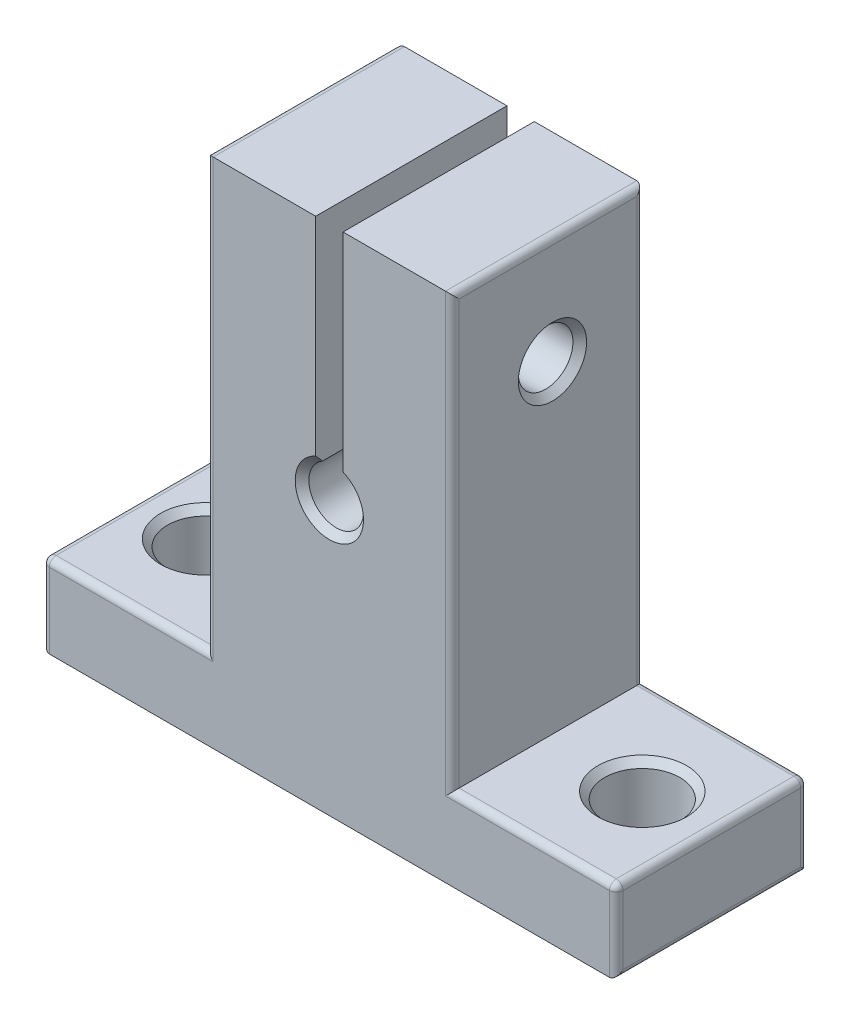
from build123d import *

# Parameters (mm, degrees)
BOSS_EXTRUDE1_DEPTH     = 7
SKETCH2_R               = 2.75
CUT_EXTRUDE1_DEPTH      = 39.5
CUT_EXTRUDE2_DEPTH      = 42.512046444
CUT_EXTRUDE2_DEPTH_BACK = 42.512046444
SKETCH5_R               = 2
CHAMFER2_SIZE           = 0.5
FILLET2_R               = 0.5


with BuildPart() as part:
    # Sketch1 → Boss-Extrude1 (new, symmetric)
    with BuildSketch(Plane.XY):
        with BuildLine():
            Line((-21, -3), (-21, 3))
            Line((-21, 3), (-9, 3))
            Line((-9, 3), (-9, 34.5))
            Line((-9, 34.5), (-1, 34.5))
            Line((-1, 34.5), (-1, 18.732050808))
            ThreePointArc((-1, 18.732050808), (0, 15), (1, 18.732050808))
            Line((1, 18.732050808), (1, 34.5))
            Line((1, 34.5), (9, 34.5))
            Line((9, 34.5), (9, 3))
            Line((9, 3), (21, 3))
            Line((21, 3), (21, -3))
            Line((21, -3), (-21, -3))
        make_face()
    extrude(amount=BOSS_EXTRUDE1_DEPTH, both=True)

    # Sketch2 → Cut-Extrude1 (cut, through all)
    with BuildSketch(Plane(origin=(0, 3, 0), x_dir=(1, 0, 0), z_dir=(0, 1, 0))):
        with Locations(Location((15.904501915, 0, 0), (0, 0, 180))):
            Circle(SKETCH2_R)
        with Locations((-16.095498085, 0)):
            Circle(SKETCH2_R)
    extrude(amount=-CUT_EXTRUDE1_DEPTH, mode=Mode.SUBTRACT)

    # Sketch5 → Cut-Extrude2 (cut, two sides: drawn at the far end of the back side and taken through both)
    with BuildSketch(Plane(origin=(-1, 0, 0), x_dir=(0, 0, -1), z_dir=(1, 0, 0)).offset(-CUT_EXTRUDE2_DEPTH_BACK)):
        with Locations((0.330734984, 26.616025404)):
            Circle(SKETCH5_R)
    extrude(amount=CUT_EXTRUDE2_DEPTH + CUT_EXTRUDE2_DEPTH_BACK, mode=Mode.SUBTRACT)

    # Chamfer2
    chamfer2_edges = [part.edges().sort_by_distance(p)[0] for p in [
        (0, 15, -7),
        (0, 15, 7),
        (18.654501915, 3, 0),
        (-18.845498085, 3, 0),
        (-9, 26.616025404, 1.669265016),
        (9, 26.616025404, 1.669265016),
    ]]
    chamfer(chamfer2_edges, length=CHAMFER2_SIZE)

    # Fillet2
    fillet2_edges = [part.edges().sort_by_distance(p)[0] for p in [
        (-15, 3, 7),
        (9, 18.75, -7),
        (15, 3, -7),
        (-21, 0, 7),
        (21, 0, -7),
        (-21, 0, -7),
        (-15, 3, -7),
        (-9, 18.75, -7),
        (21, 0, 7),
        (9, 34.5, 0),
        (21, 3, 0),
        (21, -3, 0),
        (-21, -3, 0),
        (-21, 3, 0),
        (-9, 34.5, 0),
        (15, 3, 7),
        (9, 18.75, 7),
        (-9, 18.75, 7),
    ]]
    fillet(fillet2_edges, radius=FILLET2_R)


solid = part.part
